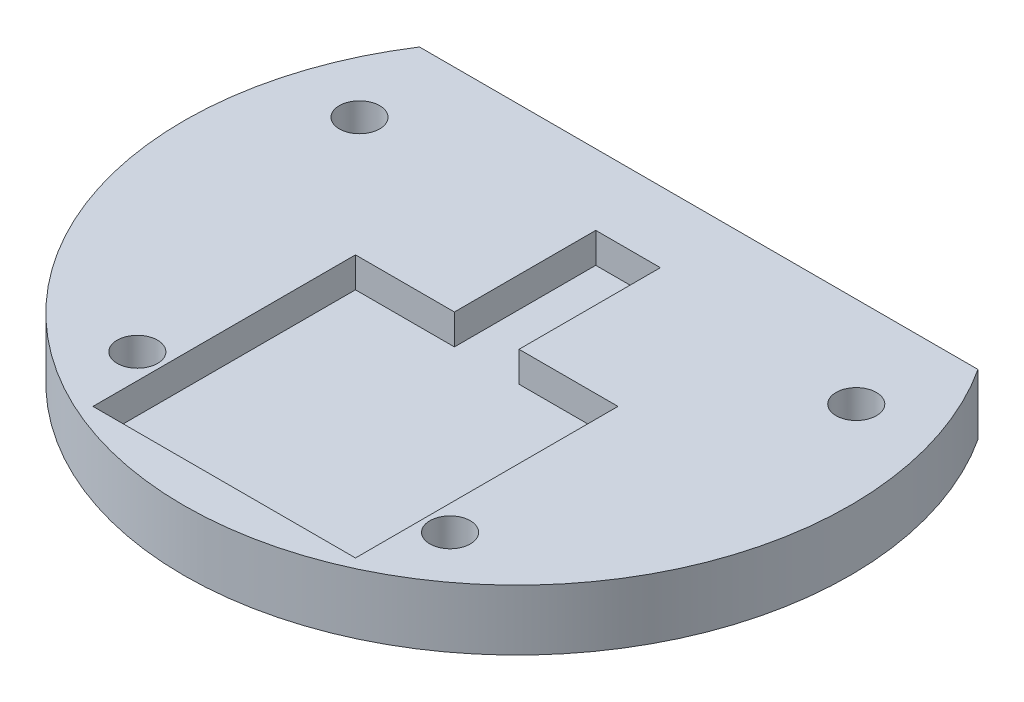
from build123d import *

# Parameters (mm, degrees)
SKETCH_1_R          = 16.5
EXTRUDE_1_DEPTH     = 3
SKETCH_2_W          = 13
SKETCH_2_H          = 13
CUT_EXTRUDE_1_DEPTH = 1.5
SKETCH_3_W          = 3.2
SKETCH_3_H          = 7
CUT_EXTRUDE_2_DEPTH = 1.5
SKETCH_4_R          = 1.5
SKETCH_4_R_2        = 1
CUT_EXTRUDE_3_DEPTH = 1
SKETCH_4_2_R        = 1
CUT_EXTRUDE_4_DEPTH = 24.526580712
SKETCH_5_W          = 27.658633372
SKETCH_5_H          = 9.051760597
CUT_EXTRUDE_5_DEPTH = 24.526580712


with BuildPart() as part:
    # 草图1 → 凸台-拉伸1 (new body)
    with BuildSketch(Plane(origin=(0, 0, 0), x_dir=(1, 0, 0), z_dir=(0, 1, 0))):
        with Locations(Location((0, 0, 0), (0, 0, 270))):
            Circle(SKETCH_1_R)
    extrude(amount=EXTRUDE_1_DEPTH)

    # 草图2 → 切除-拉伸1 (cut)
    with BuildSketch(Plane(origin=(0, 3, 0), x_dir=(1, 0, 0), z_dir=(0, 1, 0))):
        with Locations((0, -8)):
            Rectangle(SKETCH_2_W, SKETCH_2_H)
    extrude(amount=-CUT_EXTRUDE_1_DEPTH, mode=Mode.SUBTRACT)

    # 草图3 → 切除-拉伸2 (cut)
    with BuildSketch(Plane(origin=(0, 3, 0), x_dir=(1, 0, 0), z_dir=(0, 1, 0))):
        with Locations((0, 2)):
            Rectangle(SKETCH_3_W, SKETCH_3_H)
    extrude(amount=-CUT_EXTRUDE_2_DEPTH, mode=Mode.SUBTRACT)

    # 草图4 → 切除-拉伸3 (cut)
    # profile 1 of 4: a face of its own
    with BuildSketch(Plane.XZ):
        with Locations(Location((7.743281891, 11.058552598, 0), (0, 0, 270))):
            Circle(SKETCH_4_R)
        with Locations(Location((7.743281891, 11.058552598, 0), (0, 0, 270))):
            Circle(SKETCH_4_R_2, mode=Mode.SUBTRACT)
    # profile 2 of 4: a face of its own
    with BuildSketch(Plane.XZ):
        with Locations(Location((-7.743281891, 11.058552598, 0), (0, 0, 270))):
            Circle(SKETCH_4_R)
        with Locations(Location((-7.743281891, 11.058552598, 0), (0, 0, 270))):
            Circle(SKETCH_4_R_2, mode=Mode.SUBTRACT)
    # profile 3 of 4: a face of its own
    with BuildSketch(Plane.XZ):
        with Locations(Location((-12.3, -4.5, 0), (0, 0, 270))):
            Circle(SKETCH_4_R)
        with Locations(Location((-12.3, -4.5, 0), (0, 0, 270))):
            Circle(SKETCH_4_R_2, mode=Mode.SUBTRACT)
    # profile 4 of 4: a face of its own
    with BuildSketch(Plane.XZ):
        with Locations(Location((12.3, -4.5, 0), (0, 0, 270))):
            Circle(SKETCH_4_R)
        with Locations(Location((12.3, -4.5, 0), (0, 0, 270))):
            Circle(SKETCH_4_R_2, mode=Mode.SUBTRACT)
    extrude(amount=-CUT_EXTRUDE_3_DEPTH, mode=Mode.SUBTRACT)

    # 草图4<2> → 切除-拉伸4 (cut, through all)
    with BuildSketch(Plane.XZ):
        with Locations(Location((7.743281891, 11.058552598, 0), (0, 0, 270))):
            Circle(SKETCH_4_2_R)
        with Locations(Location((-7.743281891, 11.058552598, 0), (0, 0, 270))):
            Circle(SKETCH_4_2_R)
        with Locations(Location((-12.3, -4.5, 0), (0, 0, 270))):
            Circle(SKETCH_4_2_R)
        with Locations(Location((12.3, -4.5, 0), (0, 0, 270))):
            Circle(SKETCH_4_2_R)
    extrude(amount=-CUT_EXTRUDE_4_DEPTH, mode=Mode.SUBTRACT)

    # 草图5 → 切除-拉伸5 (cut, through all)
    with BuildSketch(Plane(origin=(0, 3, 0), x_dir=(1, 0, 0), z_dir=(0, 1, 0))):
        with Locations((0, 13.525880299)):
            Rectangle(SKETCH_5_W, SKETCH_5_H)
    extrude(amount=-CUT_EXTRUDE_5_DEPTH, mode=Mode.SUBTRACT)


solid = part.part
